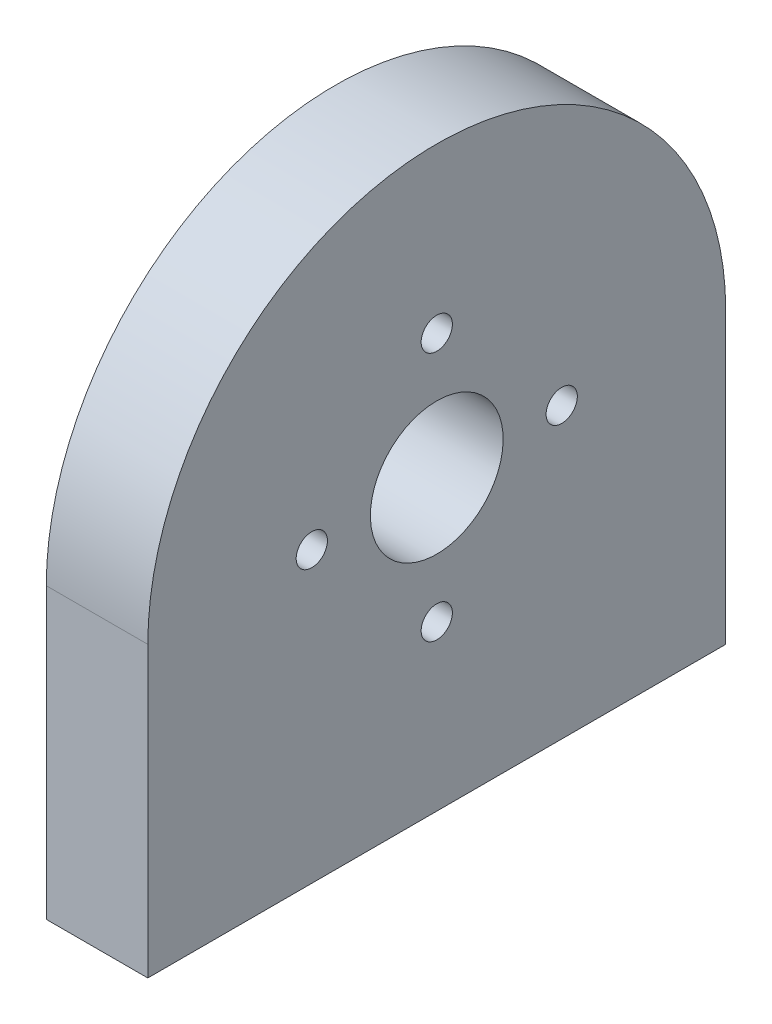
from build123d import *

# Parameters (mm, degrees)
SKETCH1_W               = 50
SKETCH1_H               = 150
BOSS_EXTRUDE1_DEPTH     = 55
CUT_EXTRUDE1_DEPTH      = 168.406690428
CUT_EXTRUDE1_DEPTH_BACK = 45
SKETCH2_R               = 10.25
SKETCH7_R               = 1
SKETCH7_R_2             = 4.25
CUT_EXTRUDE3_DEPTH      = 10
SKETCH8_W               = 55
SKETCH8_H               = 55
SKETCH8_R               = 10.25
BOSS_EXTRUDE2_DEPTH     = 50
SKETCH10_W              = 8
SKETCH10_H              = 10.25
SKETCH10_W_2            = 17
SKETCH10_H_2            = 1
SKETCH10_W_3            = 34
SKETCH10_H_3            = 20
SKETCH10_H_4            = 5
CUT_EXTRUDE4_DEPTH      = 214.717102732
SKETCH11_W              = 34
SKETCH11_H              = 13.25
BOSS_EXTRUDE4_DEPTH     = 25
SKETCH13_W              = 55
SKETCH13_H              = 10
CUT_EXTRUDE5_DEPTH      = 8
SKETCH14_R              = 5.030159043
CUT_EXTRUDE6_DEPTH      = 8
SKETCH15_W              = 34
SKETCH15_H              = 0.25
BOSS_EXTRUDE5_DEPTH     = 13.25
CUT_EXTRUDE7_DEPTH      = 181.416185527
BOSS_EXTRUDE6_START     = 1.5
SKETCH19_R              = 10.25
SKETCH19_R_2            = 1
SKETCH19_R_3            = 4.25
BOSS_EXTRUDE6_DEPTH     = 1.5
CUT_EXTRUDE8_DEPTH      = 184.89467094
SKETCH21_R              = 5.030159043
SKETCH21_R_2            = 4.5
BOSS_EXTRUDE7_DEPTH     = 8
SKETCH24_W              = 4
SKETCH24_H              = 30
CUT_EXTRUDE10_DEPTH     = 181.416185527
SKETCH25_W              = 55
SKETCH25_H              = 86.25
CUT_EXTRUDE11_DEPTH     = 4
BOSS_EXTRUDE8_START     = 4
SKETCH26_R              = 1
SKETCH26_R_2            = 4.25
BOSS_EXTRUDE8_DEPTH     = 4
SKETCH27_W              = 4
SKETCH27_H              = 123.25
CUT_EXTRUDE12_DEPTH     = 181.416185527
CUT_EXTRUDE13_DEPTH     = 180.905530765
SKETCH29_W              = 42
SKETCH29_H              = 9
CUT_EXTRUDE15_DEPTH     = 174.776436838
SKETCH30_R              = 4.5
SKETCH30_R_2            = 1.45
BOSS_EXTRUDE9_DEPTH     = 4
SKETCH31_W              = 37
SKETCH31_H              = 55
CUT_EXTRUDE16_DEPTH     = 182.05247858
SKETCH32_W              = 73.968301754
SKETCH32_H              = 92.223299302
CUT_EXTRUDE17_DEPTH     = 182.05247858


with BuildPart() as part:
    # Sketch1 → Boss-Extrude1 (new body)
    with BuildSketch(Plane.XY):
        with Locations((0, -75)):
            Rectangle(SKETCH1_W, SKETCH1_H)
    extrude(amount=-BOSS_EXTRUDE1_DEPTH)

    # Sketch2 → Cut-Extrude1 (cut, two sides: drawn at the far end of the back side and taken through both)
    with BuildSketch(Plane(origin=(25, 0, 0), x_dir=(0, 0, -1), z_dir=(1, 0, 0)).offset(-CUT_EXTRUDE1_DEPTH_BACK)):
        with Locations(Location((27.5, -25, 0), (0, 0, 270))):
            Circle(SKETCH2_R)
    extrude(amount=CUT_EXTRUDE1_DEPTH + CUT_EXTRUDE1_DEPTH_BACK, mode=Mode.SUBTRACT)

    # Sketch7 → Cut-Extrude3 (cut)
    with BuildSketch(Plane(origin=(-20, 0, 0), x_dir=(0, 0, -1), z_dir=(1, 0, 0))):
        with Locations(Location((27.5, -17, 0), (0, 0, 90))):
            Circle(SKETCH7_R)
        with Locations(Location((35.5, -25, 0), (0, 0, 90))):
            Circle(SKETCH7_R)
        with Locations(Location((27.5, -33, 0), (0, 0, 90))):
            Circle(SKETCH7_R)
        with Locations(Location((19.5, -25, 0), (0, 0, 90))):
            Circle(SKETCH7_R)
        with Locations(Location((27.5, -25, 0), (0, 0, 90))):
            Circle(SKETCH7_R_2)
    extrude(amount=-CUT_EXTRUDE3_DEPTH, mode=Mode.SUBTRACT)

    # Sketch8 → Boss-Extrude2 (add)
    with BuildSketch(Plane(origin=(25, 0, 0), x_dir=(0, 0, -1), z_dir=(1, 0, 0))):
        with Locations((27.5, -177.5)):
            Rectangle(SKETCH8_W, SKETCH8_H)
        with Locations(Location((27.5, -180, 0), (0, 0, 90))):
            Circle(SKETCH8_R, mode=Mode.SUBTRACT)
    extrude(amount=-BOSS_EXTRUDE2_DEPTH)

    # Sketch10 → Cut-Extrude4 (cut, through all)
    with BuildSketch(Plane.XY):
        Polygon((-17, -205), (17, -205), (17, -191.25), (0, -191.25), (-17, -191.25), align=None)
        Polygon((-25, -205), (-17, -205), (-17, -191.25), (-17, -190.25), (-25, -190.25), align=None)
        Polygon((17, -191.25), (17, -205), (25, -205), (25, -190.25), (17, -190.25), align=None)
        with Locations((-21, -185.125)):
            Rectangle(SKETCH10_W, SKETCH10_H)
        with Locations((-21, -174.875)):
            Rectangle(SKETCH10_W, SKETCH10_H)
        with Locations((21, -174.875)):
            Rectangle(SKETCH10_W, SKETCH10_H)
        with Locations((21, -185.125)):
            Rectangle(SKETCH10_W, SKETCH10_H)
        with Locations((-8.5, -185.125)):
            Rectangle(SKETCH10_W_2, SKETCH10_H)
        with Locations((8.5, -185.125)):
            Rectangle(SKETCH10_W_2, SKETCH10_H)
        Polygon((0, -180), (17, -180), (17, -169.75), (-17, -169.75), (-17, -180), align=None)
        with Locations((-8.5, -190.75)):
            Rectangle(SKETCH10_W_2, SKETCH10_H_2)
        with Locations((8.5, -190.75)):
            Rectangle(SKETCH10_W_2, SKETCH10_H_2)
        with Locations((0, -154.75)):
            Rectangle(SKETCH10_W_3, SKETCH10_H_3)
        with Locations((0, -167.25)):
            Rectangle(SKETCH10_W_3, SKETCH10_H_4)
    extrude(amount=-CUT_EXTRUDE4_DEPTH, mode=Mode.SUBTRACT)

    # Sketch11 → Boss-Extrude4 (add)
    with BuildSketch(Plane.XZ.offset(144.75)):
        with Locations((0, -6.625)):
            Rectangle(SKETCH11_W, SKETCH11_H)
        with Locations((0, -48.375)):
            Rectangle(SKETCH11_W, SKETCH11_H)
    extrude(amount=BOSS_EXTRUDE4_DEPTH)

    # Sketch13 → Cut-Extrude5 (cut)
    with BuildSketch(Plane(origin=(25, 0, 0), x_dir=(0, 0, -1), z_dir=(1, 0, 0))):
        with Locations((27.5, -164.75)):
            Rectangle(SKETCH13_W, SKETCH13_H)
    cut_extrude5 = extrude(amount=-CUT_EXTRUDE5_DEPTH, mode=Mode.SUBTRACT)

    # Mirror2: Cut-Extrude5 across plane
    add(cut_extrude5.mirror(Plane(origin=(0, 0, 0), x_dir=(0, 0, 1), z_dir=(1, 0, 0))), mode=Mode.SUBTRACT)

    # Sketch14 → Cut-Extrude6 (cut)
    with BuildSketch(Plane(origin=(25, 0, 0), x_dir=(0, 0, -1), z_dir=(1, 0, 0))):
        with Locations(Location((16.5, -148, 0), (0, 0, 90))):
            Circle(SKETCH14_R)
        with Locations(Location((38.5, -148, 0), (0, 0, 90))):
            Circle(SKETCH14_R)
    cut_extrude6 = extrude(amount=-CUT_EXTRUDE6_DEPTH, mode=Mode.SUBTRACT)

    # Mirror3: Cut-Extrude6 across plane
    add(cut_extrude6.mirror(Plane(origin=(0, 0, 0), x_dir=(0, 0, 1), z_dir=(1, 0, 0))), mode=Mode.SUBTRACT)

    # Sketch15 → Boss-Extrude5 (add)
    with BuildSketch(Plane.XY):
        with Locations((0, -169.875)):
            Rectangle(SKETCH15_W, SKETCH15_H)
    boss_extrude5 = extrude(amount=-BOSS_EXTRUDE5_DEPTH)

    # Mirror4: Boss-Extrude5 across plane
    add(boss_extrude5.mirror(Plane.XY.offset(-27.5)))

    # Sketch16 → Cut-Extrude7 (cut, through all)
    with BuildSketch(Plane.XY):
        Polygon((-18.5, 0), (-18.5, -14.75), (-18.5, -35.25), (-18.5, -43.5), (25, -43.5), (25, 0), align=None)
    extrude(amount=-CUT_EXTRUDE7_DEPTH, mode=Mode.SUBTRACT)

    # Sketch19 → Boss-Extrude6 (add)
    with BuildSketch(Plane(origin=(-20, 0, 0), x_dir=(0, 0, -1), z_dir=(1, 0, 0)).offset(BOSS_EXTRUDE6_START)):
        with Locations((27.5, -25)):
            Circle(SKETCH19_R)
        with Locations(Location((27.5, -17, 0), (0, 0, 90))):
            Circle(SKETCH19_R_2, mode=Mode.SUBTRACT)
        with Locations(Location((27.5, -33, 0), (0, 0, 90))):
            Circle(SKETCH19_R_2, mode=Mode.SUBTRACT)
        with Locations(Location((19.5, -25, 0), (0, 0, 90))):
            Circle(SKETCH19_R_2, mode=Mode.SUBTRACT)
        with Locations(Location((35.5, -25, 0), (0, 0, 90))):
            Circle(SKETCH19_R_2, mode=Mode.SUBTRACT)
        with Locations(Location((27.5, -25, 0), (0, 0, 90))):
            Circle(SKETCH19_R_3, mode=Mode.SUBTRACT)
    extrude(amount=-BOSS_EXTRUDE6_DEPTH)

    # Sketch20 → Cut-Extrude8 (cut, through all)
    with BuildSketch(Plane(origin=(-18.5, 0, 0), x_dir=(0, 0, -1), z_dir=(1, 0, 0))):
        with BuildLine():
            Line((0, 0), (0, -43.5))
            Line((0, -43.5), (9, -43.5))
            Line((9, -43.5), (9, -25))
            ThreePointArc((9, -25), (27.5, -6.5), (46, -25))
            Line((46, -25), (46, -43.5))
            Line((46, -43.5), (55, -43.5))
            Line((55, -43.5), (55, 0))
            Line((55, 0), (0, 0))
        make_face()
    extrude(amount=-CUT_EXTRUDE8_DEPTH, mode=Mode.SUBTRACT)

    # Sketch21 → Boss-Extrude7 (add)
    # profile 1 of 2: a face of its own
    with BuildSketch(Plane(origin=(25, 0, 0), x_dir=(0, 0, -1), z_dir=(1, 0, 0))):
        with Locations(Location((16.5, -148, 0), (0, 0, 229.751587581))):
            Circle(SKETCH21_R)
        with Locations(Location((16.5, -148, 0), (0, 0, 90))):
            Circle(SKETCH21_R_2, mode=Mode.SUBTRACT)
    # profile 2 of 2: a face of its own
    with BuildSketch(Plane(origin=(25, 0, 0), x_dir=(0, 0, -1), z_dir=(1, 0, 0))):
        with Locations(Location((38.5, -148, 0), (0, 0, 310.248412419))):
            Circle(SKETCH21_R)
        with Locations(Location((38.5, -148, 0), (0, 0, 90))):
            Circle(SKETCH21_R_2, mode=Mode.SUBTRACT)
    boss_extrude7 = extrude(amount=-BOSS_EXTRUDE7_DEPTH)

    # Mirror5: Boss-Extrude7 across plane
    add(boss_extrude7.mirror(Plane(origin=(0, 0, 0), x_dir=(0, 0, 1), z_dir=(1, 0, 0))))

    # Sketch24 → Cut-Extrude10 (cut, through all)
    with BuildSketch(Plane.XY):
        with Locations((-23, -144.75)):
            Rectangle(SKETCH24_W, SKETCH24_H)
        with Locations((23, -144.75)):
            Rectangle(SKETCH24_W, SKETCH24_H)
    extrude(amount=-CUT_EXTRUDE10_DEPTH, mode=Mode.SUBTRACT)

    # Sketch25 → Cut-Extrude11 (cut)
    with BuildSketch(Plane(origin=(25, 0, 0), x_dir=(0, 0, -1), z_dir=(1, 0, 0))):
        with Locations((27.5, -86.625)):
            Rectangle(SKETCH25_W, SKETCH25_H)
    extrude(amount=-CUT_EXTRUDE11_DEPTH, mode=Mode.SUBTRACT)

    # Sketch26 → Boss-Extrude8 (add)
    with BuildSketch(Plane(origin=(-18.5, 0, 0), x_dir=(0, 0, -1), z_dir=(1, 0, 0)).offset(BOSS_EXTRUDE8_START)):
        with BuildLine():
            Line((46, -43.5), (46, -25))
            ThreePointArc((46, -25), (27.5, -6.5), (9, -25))
            Line((9, -25), (9, -43.5))
            Line((9, -43.5), (46, -43.5))
        make_face()
        with Locations(Location((35.5, -25, 0), (0, 0, 90))):
            Circle(SKETCH26_R, mode=Mode.SUBTRACT)
        with Locations(Location((27.5, -25, 0), (0, 0, 90))):
            Circle(SKETCH26_R_2, mode=Mode.SUBTRACT)
        with Locations(Location((19.5, -25, 0), (0, 0, 90))):
            Circle(SKETCH26_R, mode=Mode.SUBTRACT)
        with Locations(Location((27.5, -33, 0), (0, 0, 90))):
            Circle(SKETCH26_R, mode=Mode.SUBTRACT)
        with Locations(Location((27.5, -17, 0), (0, 0, 90))):
            Circle(SKETCH26_R, mode=Mode.SUBTRACT)
    extrude(amount=-BOSS_EXTRUDE8_DEPTH)

    # Sketch27 → Cut-Extrude12 (cut, through all)
    with BuildSketch(Plane.XY):
        with Locations((-23, -68.125)):
            Rectangle(SKETCH27_W, SKETCH27_H)
    extrude(amount=-CUT_EXTRUDE12_DEPTH, mode=Mode.SUBTRACT)

    # Sketch28 → Cut-Extrude13 (cut, through all)
    with BuildSketch(Plane.XY):
        with BuildLine():
            Line((21, -43.5), (-14.5, -43.5))
            ThreePointArc((-14.5, -43.5), (10.602290732, -53.897709268), (21, -79))
            Line((21, -79), (21, -43.5))
        make_face()
    extrude(amount=-CUT_EXTRUDE13_DEPTH, mode=Mode.SUBTRACT)

    # Sketch29 → Cut-Extrude15 (cut, through all)
    with BuildSketch(Plane.XZ.offset(170)):
        with Locations((0, -50.5)):
            Rectangle(SKETCH29_W, SKETCH29_H)
        with Locations((0, -4.5)):
            Rectangle(SKETCH29_W, SKETCH29_H)
    extrude(amount=-CUT_EXTRUDE15_DEPTH, mode=Mode.SUBTRACT)

    # Sketch30 → Boss-Extrude9 (add)
    # profile 1 of 2: a face of its own
    with BuildSketch(Plane(origin=(21, 0, 0), x_dir=(0, 0, -1), z_dir=(1, 0, 0))):
        with Locations(Location((16.5, -148, 0), (0, 0, 223.761742693))):
            Circle(SKETCH30_R)
        with Locations((16.5, -148)):
            Circle(SKETCH30_R_2, mode=Mode.SUBTRACT)
    # profile 2 of 2: a face of its own
    with BuildSketch(Plane(origin=(21, 0, 0), x_dir=(0, 0, -1), z_dir=(1, 0, 0))):
        with Locations(Location((38.5, -148, 0), (0, 0, 316.238257307))):
            Circle(SKETCH30_R)
        with Locations((38.5, -148)):
            Circle(SKETCH30_R_2, mode=Mode.SUBTRACT)
    boss_extrude9 = extrude(amount=-BOSS_EXTRUDE9_DEPTH)

    # Mirror6: Boss-Extrude9 across plane
    add(boss_extrude9.mirror(Plane(origin=(0, 0, 0), x_dir=(0, 0, 1), z_dir=(1, 0, 0))))

    # Sketch31 → Cut-Extrude16 (cut, through all)
    with BuildSketch(Plane.ZY.offset(21)):
        with Locations((-27.5, -71)):
            Rectangle(SKETCH31_W, SKETCH31_H)
    extrude(amount=-CUT_EXTRUDE16_DEPTH, mode=Mode.SUBTRACT)


with BuildPart() as cut_extrude16_piece_1:
    # of the separate pieces the step leaves, piece 1, a body of its own (cut_extrude16_pieces)
    add(part.part.solids().sort_by_distance((17, -170, -13.25))[0])

    # Sketch32 → Cut-Extrude17 (cut, through all)
    with BuildSketch(Plane.ZY.offset(21)):
        with Locations((-28.833527464, -129.267729309)):
            Rectangle(SKETCH32_W, SKETCH32_H)
    extrude(amount=-CUT_EXTRUDE17_DEPTH, mode=Mode.SUBTRACT)


with BuildPart() as cut_extrude16_piece_2:
    # of the separate pieces the step leaves, piece 2, a body of its own (cut_extrude16_pieces)
    add(part.part.solids().sort_by_distance((-21, -43.5, -9))[0])


solid = cut_extrude16_piece_2.part
